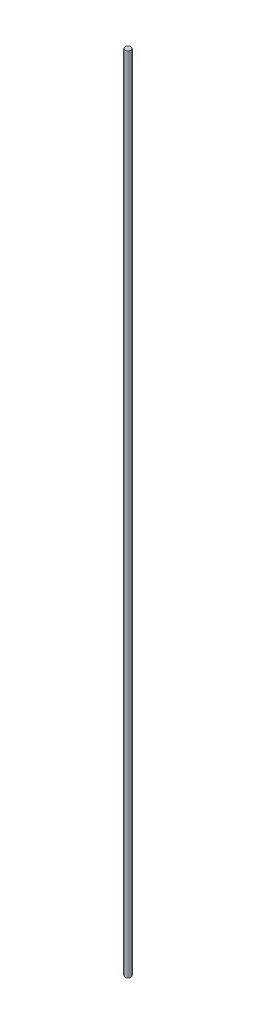
from build123d import *

# Parameters (mm, degrees)
SKETCH_1_R      = 15
EXTRUDE_1_DEPTH = 4000


with BuildPart() as part:
    # Эскиз1 → Бобышка-Вытянуть1 (new body)
    with BuildSketch(Plane(origin=(0, 0, 0), x_dir=(1, 0, 0), z_dir=(0, 1, 0))):
        Circle(SKETCH_1_R)
    extrude(amount=EXTRUDE_1_DEPTH)


solid = part.part
